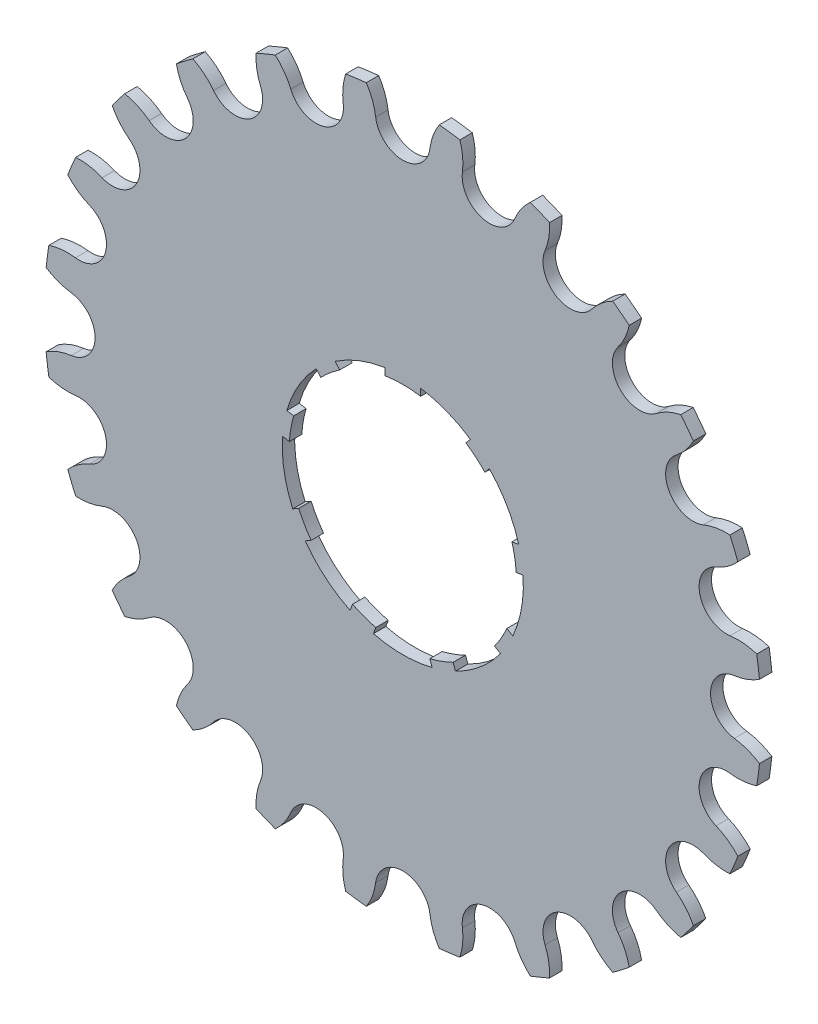
from build123d import *

# Parameters (mm, degrees)
SK_DISCO_R           = 52.043038616
DISCO_DEPTH          = 1.8
HUECO_DIENTE_DEPTH   = 74.621978625
MATRIZ_DIENTES_COUNT = 24


with BuildPart() as part:
    # Sk_Disco → Disco (new body)
    with BuildSketch(Plane.XY):
        Circle(SK_DISCO_R)
        with BuildLine():
            Line((2.6, 17.305779381), (2.6, 16.293863876))
            ThreePointArc((2.6, 16.293863876), (0, 16.5), (-2.6, 16.293863876))
            Line((-2.6, 16.293863876), (-2.6, 17.305779381))
            ThreePointArc((-2.6, 17.305779381), (-6.362648192, 16.302352836), (-9.810241185, 14.491693065))
            Line((-9.810241185, 14.491693065), (-9.163816615, 13.721314261))
            ThreePointArc((-9.163816615, 13.721314261), (-10.60599556, 12.639733311), (-11.92157661, 11.407278866))
            Line((-11.92157661, 11.407278866), (-12.56800118, 12.17765767))
            ThreePointArc((-12.56800118, 12.17765767), (-15.155444566, 8.75), (-16.830161491, 4.795379462))
            Line((-16.830161491, 4.795379462), (-15.839781591, 4.620748764))
            ThreePointArc((-15.839781591, 4.620748764), (-16.249327925, 2.865194932), (-16.464915031, 1.075440854))
            Line((-16.464915031, 1.075440854), (-17.455294931, 1.250071551))
            ThreePointArc((-17.455294931, 1.250071551), (-17.234135678, -3.038843109), (-15.975062189, -7.144745486))
            Line((-15.975062189, -7.144745486), (-15.104136721, -6.641916433))
            ThreePointArc((-15.104136721, -6.641916433), (-14.289419162, -8.25), (-13.304136721, -9.759607887))
            Line((-13.304136721, -9.759607887), (-14.175062189, -10.26243694))
            ThreePointArc((-14.175062189, -10.26243694), (-11.24878317, -13.405777755), (-7.645053746, -15.741764616))
            Line((-7.645053746, -15.741764616), (-7.301098416, -14.796755115))
            ThreePointArc((-7.301098416, -14.796755115), (-5.643332365, -15.504928243), (-3.918204981, -16.028027631))
            Line((-3.918204981, -16.028027631), (-4.262160311, -16.973037132))
            ThreePointArc((-4.262160311, -16.973037132), (0, -17.5), (4.262160311, -16.973037132))
            Line((4.262160311, -16.973037132), (3.918204981, -16.028027631))
            ThreePointArc((3.918204981, -16.028027631), (5.643332365, -15.504928243), (7.301098416, -14.796755115))
            Line((7.301098416, -14.796755115), (7.645053746, -15.741764616))
            ThreePointArc((7.645053746, -15.741764616), (11.24878317, -13.405777755), (14.175062189, -10.26243694))
            Line((14.175062189, -10.26243694), (13.304136721, -9.759607887))
            ThreePointArc((13.304136721, -9.759607887), (14.289419162, -8.25), (15.104136721, -6.641916433))
            Line((15.104136721, -6.641916433), (15.975062189, -7.144745486))
            ThreePointArc((15.975062189, -7.144745486), (17.234135678, -3.038843109), (17.455294931, 1.250071551))
            Line((17.455294931, 1.250071551), (16.464915031, 1.075440854))
            ThreePointArc((16.464915031, 1.075440854), (16.249327925, 2.865194932), (15.839781591, 4.620748764))
            Line((15.839781591, 4.620748764), (16.830161491, 4.795379462))
            ThreePointArc((16.830161491, 4.795379462), (15.155444566, 8.75), (12.56800118, 12.17765767))
            Line((12.56800118, 12.17765767), (11.92157661, 11.407278866))
            ThreePointArc((11.92157661, 11.407278866), (10.60599556, 12.639733311), (9.163816615, 13.721314261))
            Line((9.163816615, 13.721314261), (9.810241185, 14.491693065))
            ThreePointArc((9.810241185, 14.491693065), (6.362648192, 16.302352836), (2.6, 17.305779381))
        make_face(mode=Mode.SUBTRACT)
    extrude(amount=DISCO_DEPTH)

    # Sk_Hueco → Hueco_diente (cut, through all)
    with BuildSketch(Plane.XY):
        with BuildLine():
            ThreePointArc((-3.940993324, 48.130397991), (0, 44.674239605), (3.940993324, 48.130397991))
            ThreePointArc((3.940993324, 48.130397991), (4.914589216, 51.137997952), (6.895967484, 53.601265426))
            ThreePointArc((6.895967484, 53.601265426), (0, 54.043038616), (-6.895967484, 53.601265426))
            ThreePointArc((-6.895967484, 53.601265426), (-4.914589216, 51.137997952), (-3.940993324, 48.130397991))
        make_face()
    hueco_diente = extrude(amount=HUECO_DIENTE_DEPTH, mode=Mode.SUBTRACT)

    # Matriz_dientes: Hueco_diente ×24 about axis
    matriz_dientes_axis = Axis((0, 0, -0.09), (0, 0, 1))
    for i in range(1, MATRIZ_DIENTES_COUNT):
        add(hueco_diente.rotate(matriz_dientes_axis, i * 360 / MATRIZ_DIENTES_COUNT), mode=Mode.SUBTRACT)


solid = part.part
